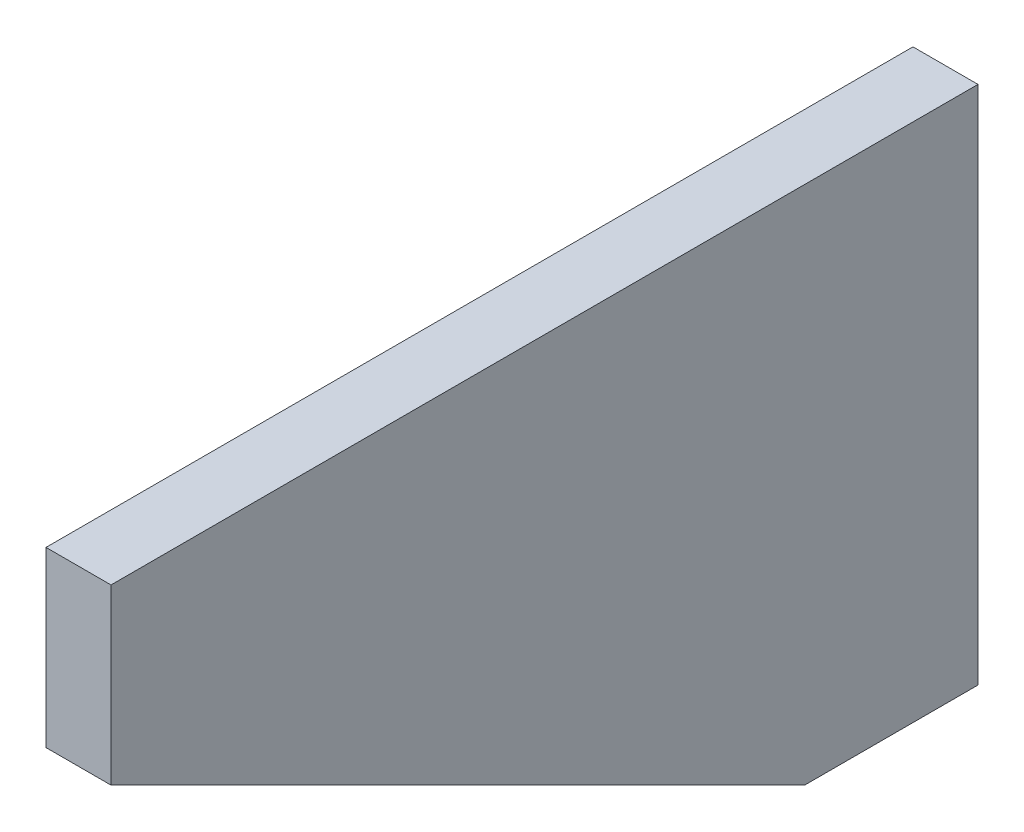
from build123d import *

# Parameters (mm, degrees)
BOSS_EXTRUDE1_DEPTH = 9.525


with BuildPart() as part:
    # Sketch1 → Boss-Extrude1 (new body)
    with BuildSketch(Plane(origin=(0, 0, 0), x_dir=(0, 0, -1), z_dir=(1, 0, 0))):
        Polygon((0, 0), (0, -76.2), (-25.4, -76.2), (-127, -25.4), (-127, 0), align=None)
    extrude(amount=BOSS_EXTRUDE1_DEPTH)


solid = part.part
